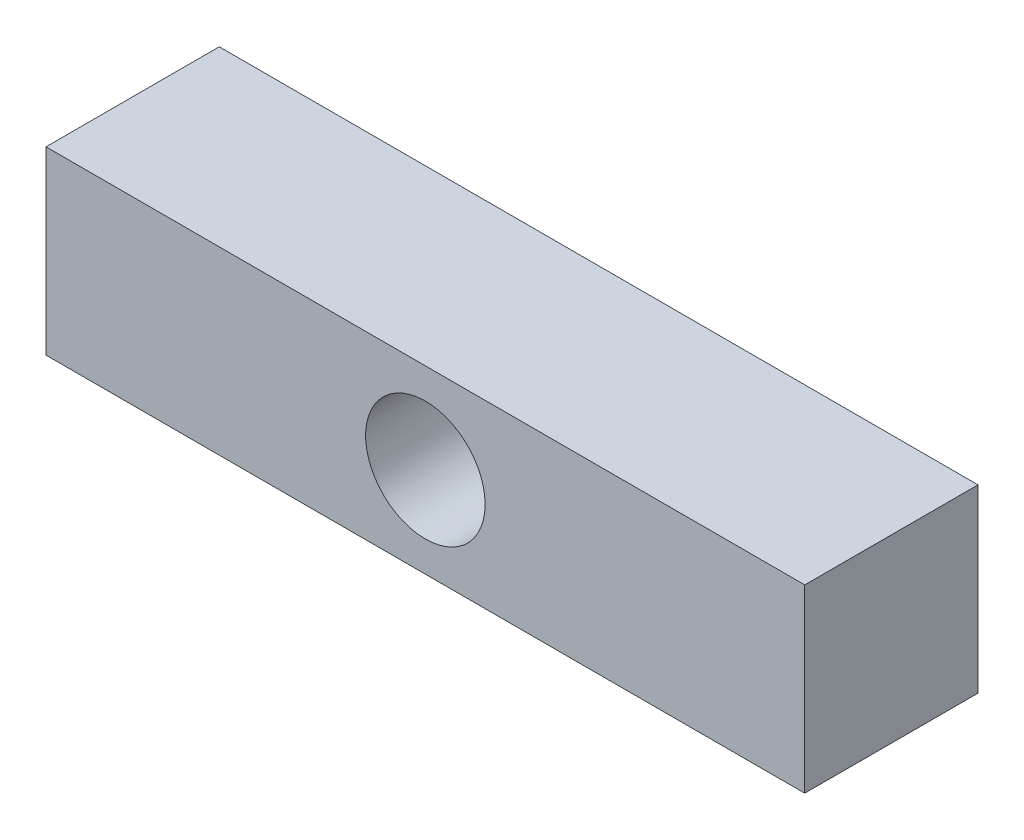
from build123d import *

# Parameters (mm, degrees)
SKETCH1_W           = 25.4
SKETCH1_H           = 5.8
BOSS_EXTRUDE1_DEPTH = 6.04
SKETCH2_R           = 2
CUT_EXTRUDE1_DEPTH  = 16.212218773


with BuildPart() as part:
    # Sketch1 → Boss-Extrude1 (new body)
    with BuildSketch(Plane(origin=(0, 0, 0), x_dir=(1, 0, 0), z_dir=(0, 1, 0))):
        Rectangle(SKETCH1_W, SKETCH1_H)
    extrude(amount=BOSS_EXTRUDE1_DEPTH)

    # Sketch2 → Cut-Extrude1 (cut, through all)
    with BuildSketch(Plane.XY.offset(2.9)):
        with Locations((0, 3.02)):
            Circle(SKETCH2_R)
    extrude(amount=-CUT_EXTRUDE1_DEPTH, mode=Mode.SUBTRACT)


solid = part.part
